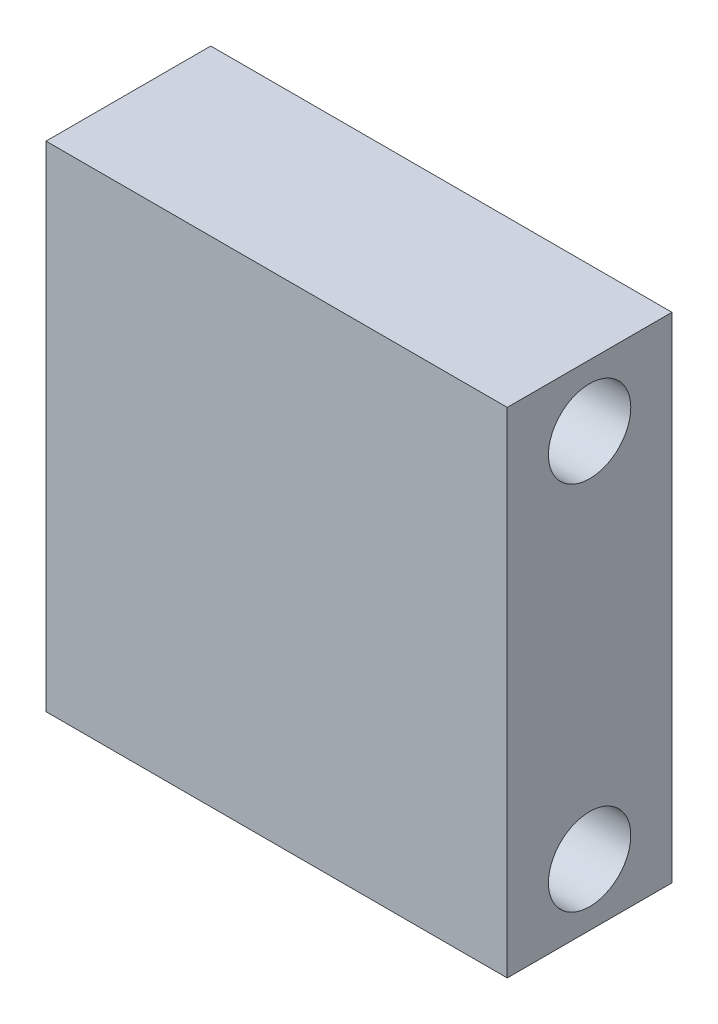
from build123d import *

# Parameters (mm, degrees)
SKETCH1_W           = 20
SKETCH1_H           = 60
SKETCH1_R           = 5
BOSS_EXTRUDE1_DEPTH = 56


with BuildPart() as part:
    # Sketch1 → Boss-Extrude1 (new body)
    with BuildSketch(Plane(origin=(0, 0, 0), x_dir=(0, 0, -1), z_dir=(1, 0, 0))):
        Rectangle(SKETCH1_W, SKETCH1_H)
        with Locations((0, 22.5)):
            Circle(SKETCH1_R, mode=Mode.SUBTRACT)
        with Locations(Location((0, -22.5, 0), (0, 0, 180))):
            Circle(SKETCH1_R, mode=Mode.SUBTRACT)
    extrude(amount=BOSS_EXTRUDE1_DEPTH)


solid = part.part
